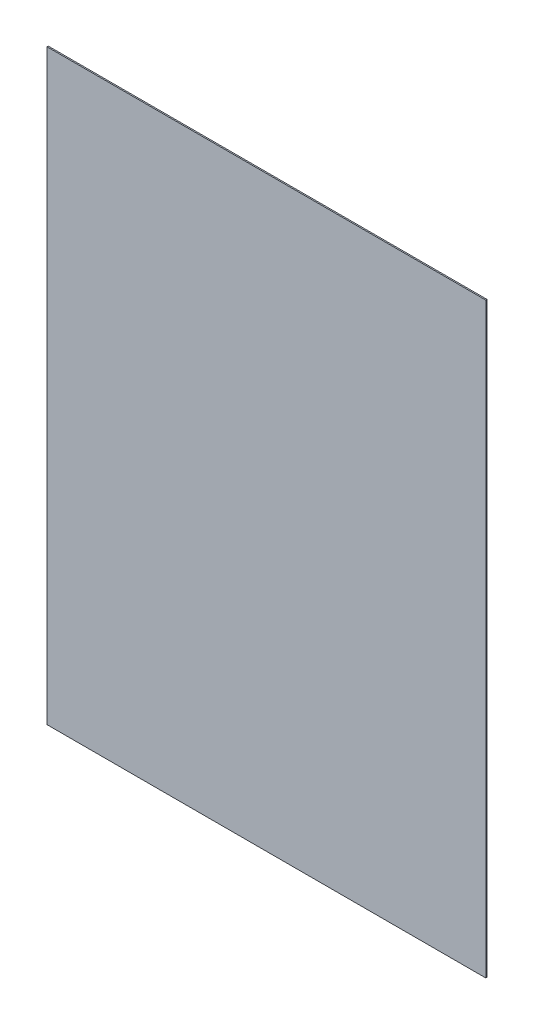
from build123d import *

# Parameters (mm, degrees)
SKETCH1_W           = 351.34
SKETCH1_H           = 470
BOSS_EXTRUDE1_DEPTH = 1


with BuildPart() as part:
    # Sketch1 → Boss-Extrude1 (new body)
    with BuildSketch(Plane.XY):
        with Locations((-129.386216216, -72.5)):
            Rectangle(SKETCH1_W, SKETCH1_H)
    extrude(amount=BOSS_EXTRUDE1_DEPTH)


solid = part.part
